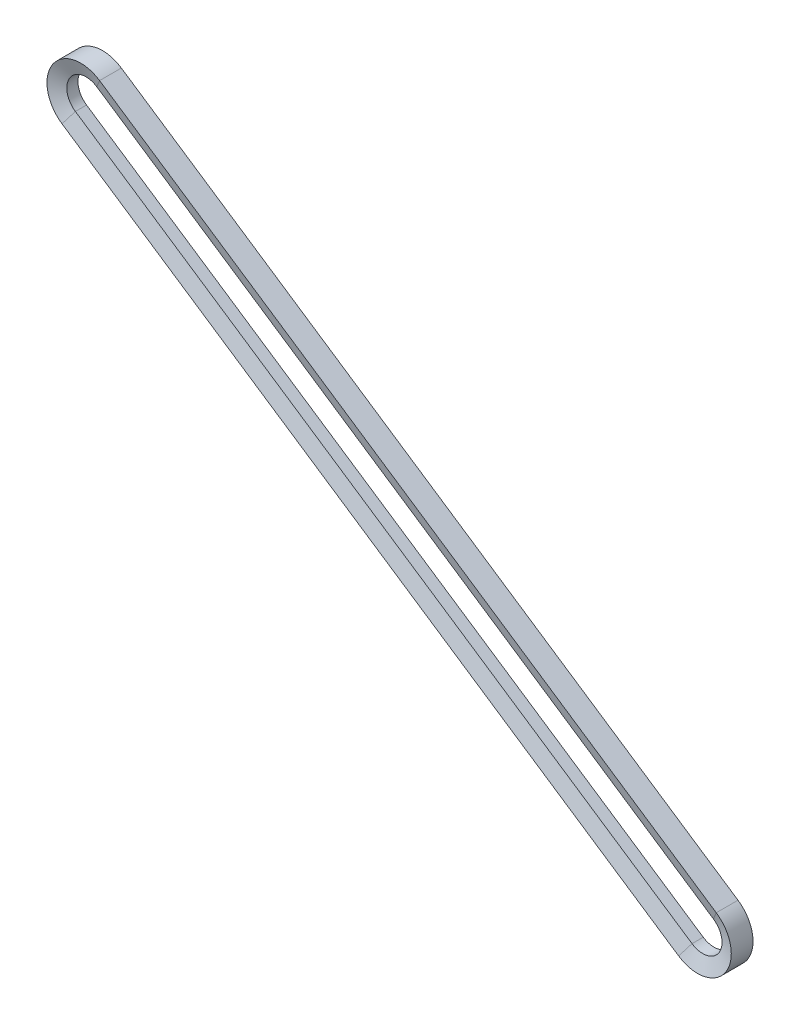
from build123d import *


with BuildPart() as part:
    # 扫描1: sweep along a path in 草图2
    with BuildLine(Plane.XY) as sweep_1_path:
        Line((2.9460795, 4.405748016), (172.541711908, -109.001150006))
        ThreePointArc((172.541711908, -109.001150006), (174.001380423, -116.352977522), (166.649552907, -117.812646037))
        Line((166.649552907, -117.812646037), (-2.9460795, -4.405748016))
        ThreePointArc((-2.9460795, -4.405748016), (-4.405748016, 2.9460795), (2.9460795, 4.405748016))
    # 草图3 → 扫描1 (sweep)
    with BuildSketch(Plane(origin=(169.595632407, -113.406898022, 0), x_dir=(0, 0, -1), z_dir=(0.8312732105361001, -0.5558640566226642, 0))):
        Polygon((-1.535, 5.3), (1.535, 5.3), (2.990880937, 9.3), (-2.990880937, 9.3), align=None)
    sweep(path=sweep_1_path.line)


solid = part.part
